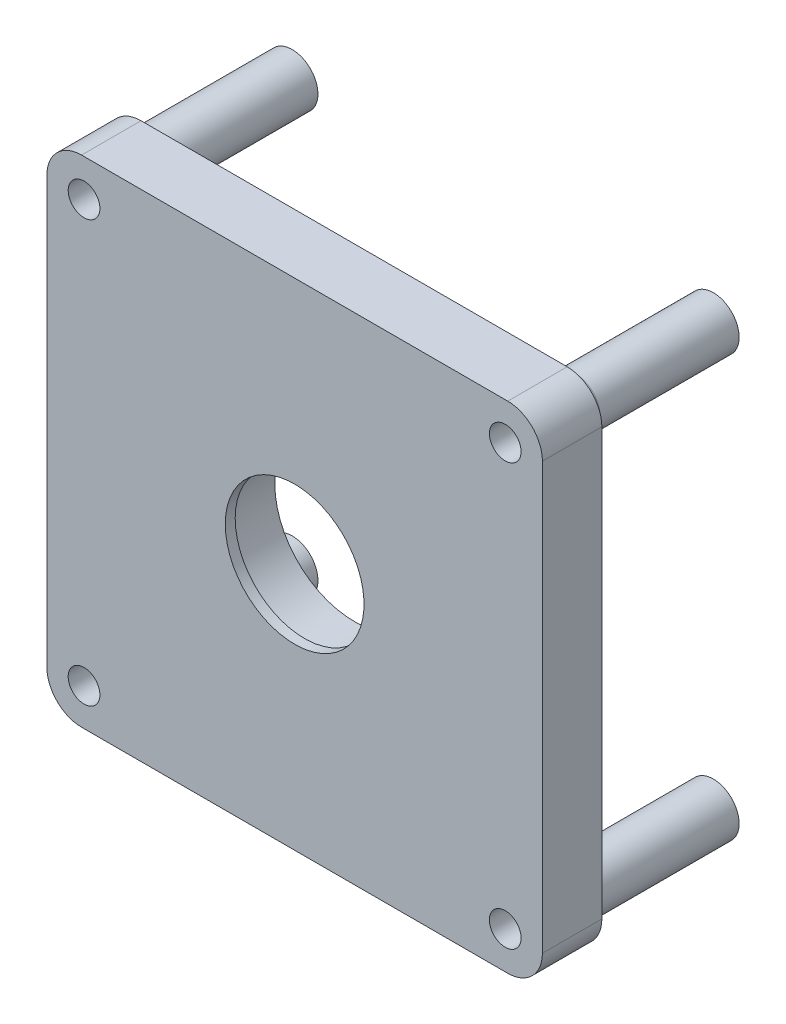
from build123d import *

# Parameters (mm, degrees)
SKETCH2_W            = 100
SKETCH2_H            = 100
BOSS_EXTRUDE1_DEPTH  = 12
SKETCH3_R            = 16
CUT_EXTRUDE1_DEPTH   = 10
M6_CLEARANCE_HOLE1_D = 6.4
BOSS_EXTRUDE2_START  = 30
SKETCH17_R           = 5.2
SKETCH17_R_2         = 3.2
BOSS_EXTRUDE2_DEPTH  = 30
CIRPATTERN1_COUNT    = 4
SKETCH18_R           = 14
CUT_EXTRUDE3_DEPTH   = 77.811457479
FILLET1_R            = 2
FILLET2_R            = 7


with BuildPart() as part:
    # Sketch2 → Boss-Extrude1 (new body)
    with BuildSketch(Plane.XY):
        Rectangle(SKETCH2_W, SKETCH2_H)
    extrude(amount=BOSS_EXTRUDE1_DEPTH)

    # Sketch3 → Cut-Extrude1 (cut)
    with BuildSketch(Plane(origin=(0, 0, 0), x_dir=(-1, 0, 0), z_dir=(0, 0, -1))):
        Circle(SKETCH3_R)
    extrude(amount=-CUT_EXTRUDE1_DEPTH, mode=Mode.SUBTRACT)

    # M6 Clearance Hole1 (through all)
    with Locations(Plane(origin=(0, 0, 12), x_dir=(-1, 0, 0), z_dir=(0, 0, 1))):
        with Locations((42.5, -42.5), (-42.5, 42.5), (-42.5, -42.5), (42.5, 42.5)):
            Hole(M6_CLEARANCE_HOLE1_D / 2)

    # Sketch17 → Boss-Extrude2 (add)
    with BuildSketch(Plane(origin=(0, 0, 0), x_dir=(-1, 0, 0), z_dir=(0, 0, -1)).offset(BOSS_EXTRUDE2_START)):
        with Locations((-42.5, 42.5)):
            Circle(SKETCH17_R)
        with Locations(Location((-42.5, 42.5, 0), (0, 0, 180))):
            Circle(SKETCH17_R_2, mode=Mode.SUBTRACT)
    boss_extrude2 = extrude(amount=-BOSS_EXTRUDE2_DEPTH)

    # CirPattern1: Boss-Extrude2 ×4 about axis
    cirpattern1_axis = Axis((0, 0, 0), (0, 0, 1))
    for i in range(1, CIRPATTERN1_COUNT):
        add(boss_extrude2.rotate(cirpattern1_axis, i * 360 / CIRPATTERN1_COUNT))

    # Sketch18 → Cut-Extrude3 (cut, through all)
    with BuildSketch(Plane(origin=(0, 0, 0), x_dir=(-1, 0, 0), z_dir=(0, 0, -1))):
        Circle(SKETCH18_R)
    extrude(amount=-CUT_EXTRUDE3_DEPTH, mode=Mode.SUBTRACT)

    # Fillet1
    fillet1_edges = [part.edges().sort_by_distance(p)[0] for p in [
        (47.7, 42.5, 0),
        (-42.5, 47.7, 0),
        (-47.7, -42.5, 0),
        (42.5, -47.7, 0),
    ]]
    fillet(fillet1_edges, radius=FILLET1_R)

    # Fillet2
    fillet2_edges = [part.edges().sort_by_distance(p)[0] for p in [
        (50, -50, 6),
        (-50, -50, 6),
        (-50, 50, 6),
        (50, 50, 6),
    ]]
    fillet(fillet2_edges, radius=FILLET2_R)


solid = part.part
